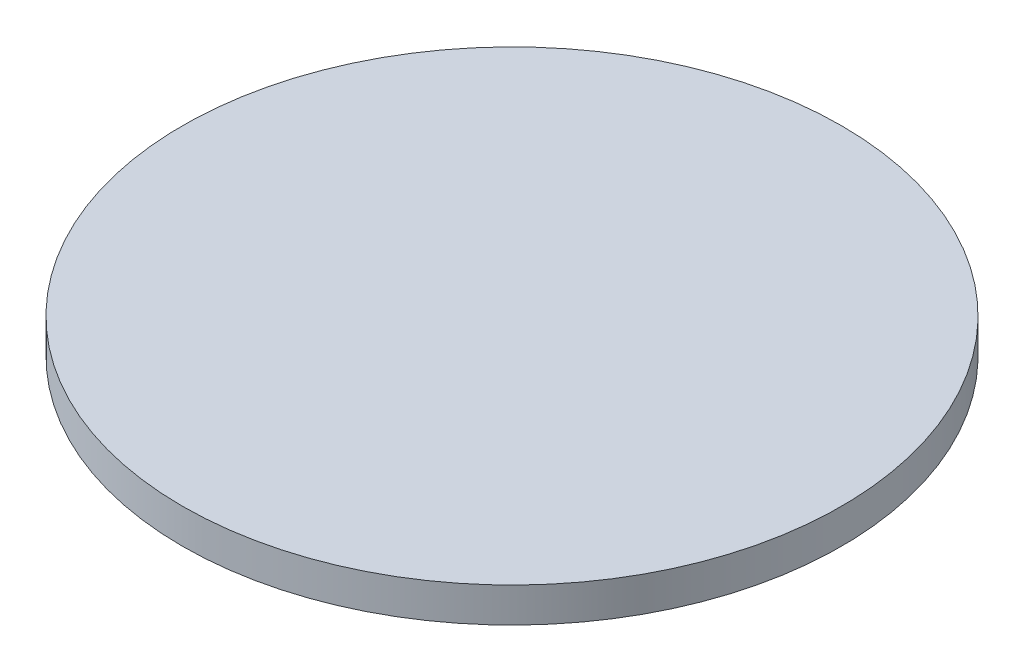
from build123d import *

# Parameters (mm, degrees)
SKETCH1_R           = 14.25
BOSS_EXTRUDE1_DEPTH = 1.5


with BuildPart() as part:
    # Sketch1 → Boss-Extrude1 (new body)
    with BuildSketch(Plane(origin=(0, 0, 0), x_dir=(1, 0, 0), z_dir=(0, 1, 0))):
        with Locations(Location((0, 0, 0), (0, 0, 270))):
            Circle(SKETCH1_R)
    extrude(amount=BOSS_EXTRUDE1_DEPTH)


solid = part.part
